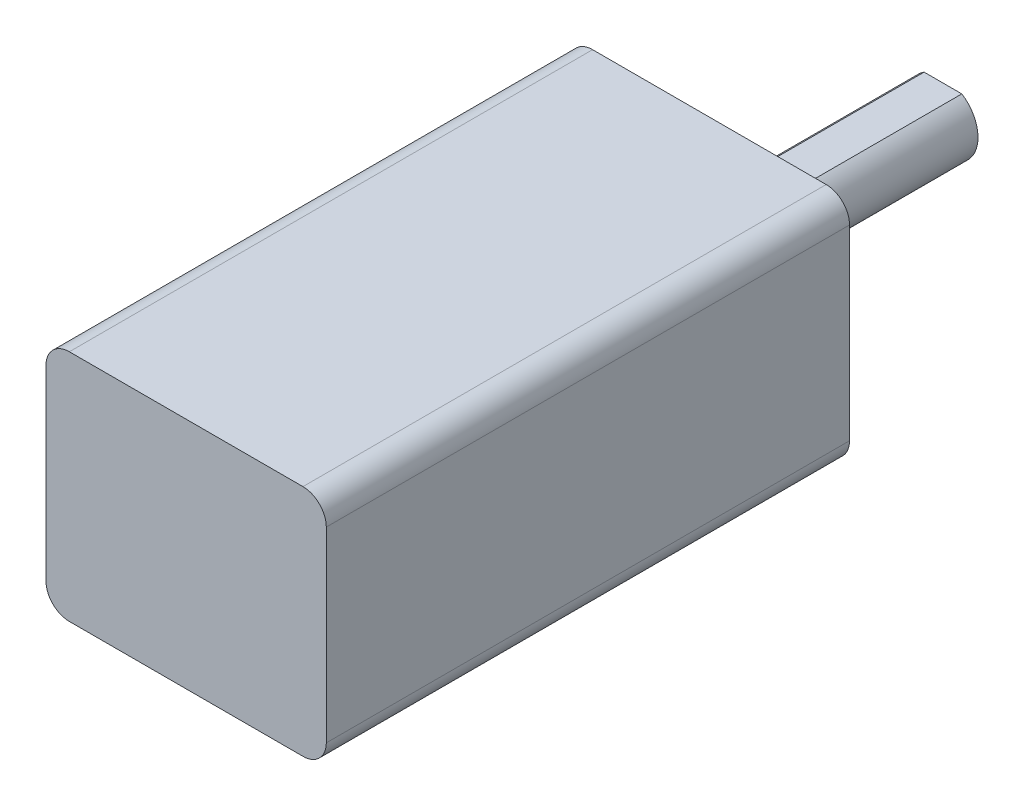
from build123d import *

# Parameters (mm, degrees)
SKETCH_1_W          = 12
SKETCH_1_H          = 10
EXTRUDE_1_DEPTH     = 22.4
SKETCH_2_R          = 1.5
EXTRUDE_2_DEPTH     = 10
FILLET_1_R          = 1
FILLET_2_R          = 1
CUT_EXTRUDE_1_DEPTH = 10


with BuildPart() as part:
    # ｽｹｯﾁ1 → ﾎﾞｽ - 押し出し1 (new body)
    with BuildSketch(Plane.XY):
        Rectangle(SKETCH_1_W, SKETCH_1_H)
    extrude(amount=EXTRUDE_1_DEPTH)

    # ｽｹｯﾁ2 → ﾎﾞｽ - 押し出し2 (add)
    with BuildSketch(Plane.XY):
        Circle(SKETCH_2_R)
    extrude(amount=-EXTRUDE_2_DEPTH)

    # ﾌｨﾚｯﾄ1
    fillet_1_edges = [part.edges().sort_by_distance(p)[0] for p in [
        (-6, 5, 11.2),
    ]]
    fillet(fillet_1_edges, radius=FILLET_1_R)

    # ﾌｨﾚｯﾄ2
    fillet_2_edges = [part.edges().sort_by_distance(p)[0] for p in [
        (-6, -5, 11.2),
        (6, 5, 11.2),
        (6, -5, 11.2),
    ]]
    fillet(fillet_2_edges, radius=FILLET_2_R)

    # ｽｹｯﾁ3 → ｶｯﾄ - 押し出し1 (cut)
    with BuildSketch(Plane.XY):
        Polygon((0, 1.5), (-1.572523441, 1.5), (-1.572523441, 1.264308846), (1.824127191, 1.264308846), (1.824127191, 1.5), align=None)
    extrude(amount=-CUT_EXTRUDE_1_DEPTH, mode=Mode.SUBTRACT)


solid = part.part
